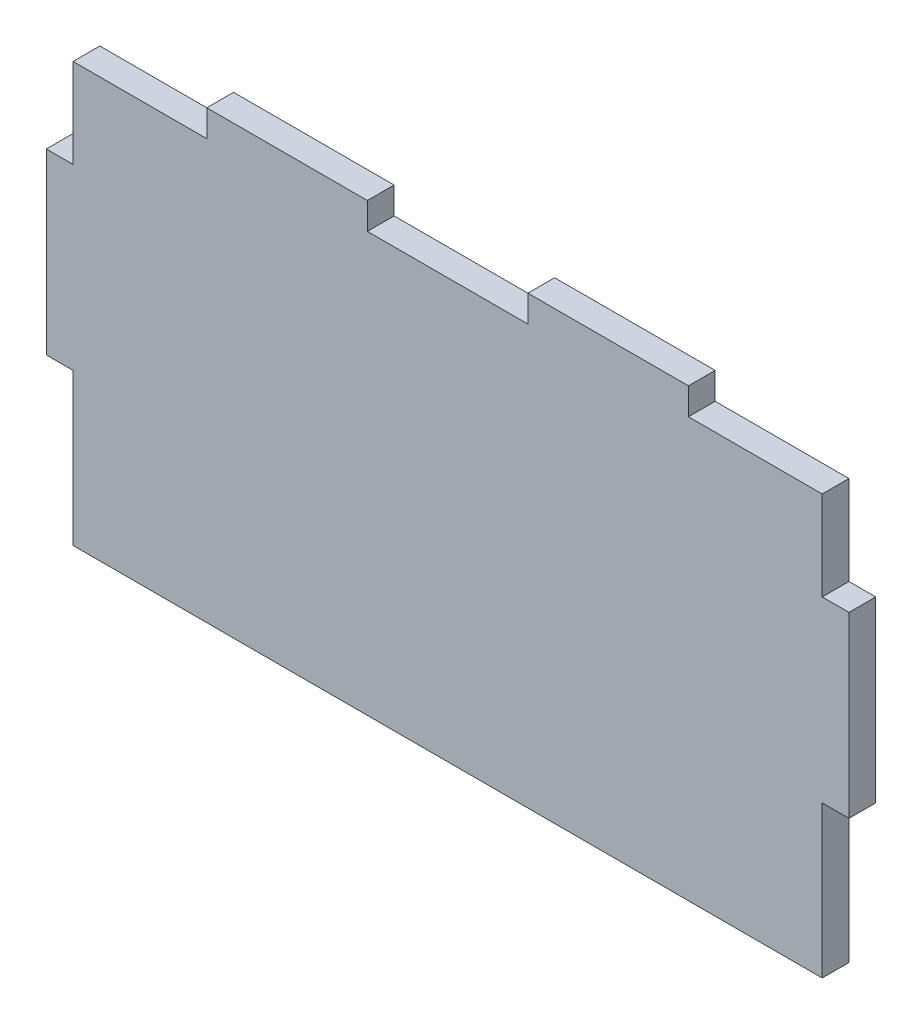
from build123d import *

# Parameters (mm, degrees)
SKETCH1_W           = 90
SKETCH1_H           = 50
BOSS_EXTRUDE1_DEPTH = 3
SKETCH2_W           = 18
SKETCH2_H           = 3
SKETCH2_W_2         = 3
SKETCH2_H_2         = 17
CUT_EXTRUDE1_DEPTH  = 3


with BuildPart() as part:
    # Sketch1 → Boss-Extrude1 (new body)
    with BuildSketch(Plane.XY):
        with Locations((45, 25)):
            Rectangle(SKETCH1_W, SKETCH1_H)
    extrude(amount=BOSS_EXTRUDE1_DEPTH)

    # Sketch2 → Cut-Extrude1 (cut)
    with BuildSketch(Plane.XY.offset(3)):
        Polygon((0, 50), (18, 50), (18, 47), (3, 47), (3, 37), (0, 37), (0, 47), align=None)
        with Locations((45, 48.5)):
            Rectangle(SKETCH2_W, SKETCH2_H)
        Polygon((90, 50), (72, 50), (72, 47), (87, 47), (87, 37), (90, 37), (90, 47), align=None)
        with Locations((88.5, 8.5)):
            Rectangle(SKETCH2_W_2, SKETCH2_H_2)
        with Locations((1.5, 8.5)):
            Rectangle(SKETCH2_W_2, SKETCH2_H_2)
    extrude(amount=-CUT_EXTRUDE1_DEPTH, mode=Mode.SUBTRACT)


solid = part.part
